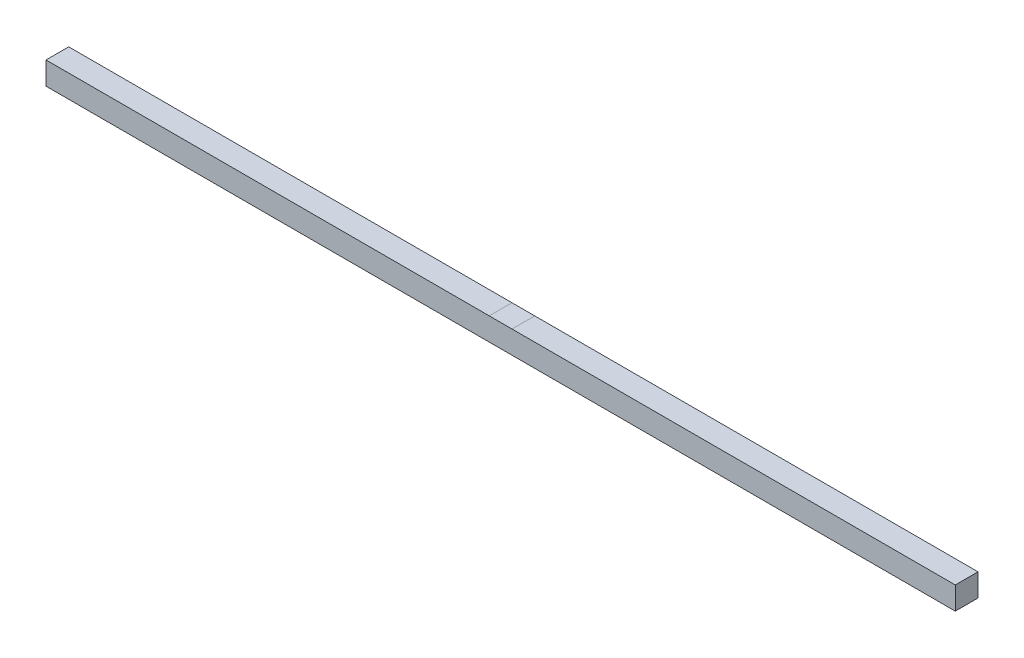
from build123d import *

# Parameters (mm, degrees)
SKETCH1_W      = 2032
SKETCH1_H      = 50.8
EXTRUDE1_DEPTH = 50.8


with BuildPart() as part:
    # Sketch1 → Extrude1 (new body)
    with BuildSketch(Plane.XY):
        with Locations((939.8, 25.4)):
            Rectangle(SKETCH1_W, SKETCH1_H)
    extrude(amount=EXTRUDE1_DEPTH)


solid = part.part
